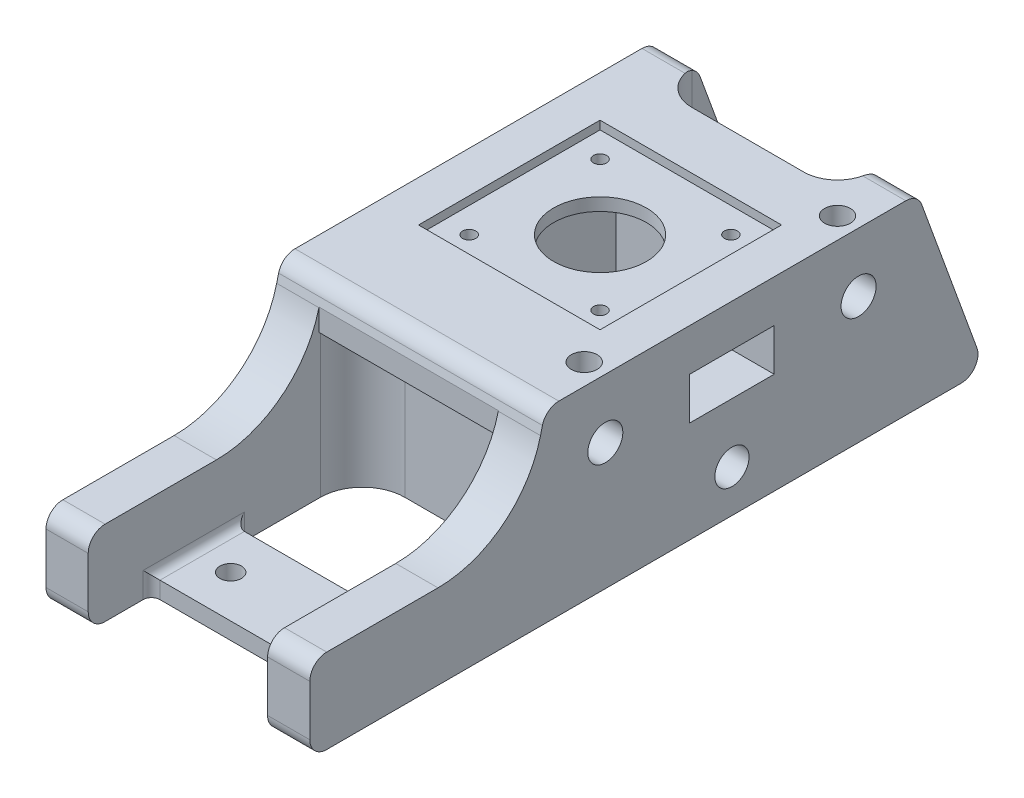
from build123d import *
from build123d.topology import SkipClean

# Parameters (mm, degrees)
SKETCH3_R            = 4.15
BOSS_EXTRUDE2_DEPTH  = 10
FILLET1_R            = 4
BOSS_EXTRUDE3_START  = 42.5
BOSS_EXTRUDE3_DEPTH  = 42.5
FILLET1_OF_MIRROR1_R = 4
SKETCH5_W            = 20
SKETCH5_H            = 10
CUT_EXTRUDE1_DEPTH   = 10
SKETCH6_R            = 11
CUT_EXTRUDE2_DEPTH   = 10
SKETCH7_W            = 43
SKETCH7_H            = 43
CUT_EXTRUDE3_DEPTH   = 2
SKETCH8_R            = 1.55
CUT_EXTRUDE4_DEPTH   = 5
SKETCH9_W            = 10
SKETCH9_H            = 34.15
BOSS_EXTRUDE4_DEPTH  = 42.5
FILLET2_R            = 10
FILLET3_R            = 8
SKETCH10_R           = 4.15
BOSS_EXTRUDE5_DEPTH  = 10
SKETCH11_R           = 4.05
CUT_EXTRUDE5_DEPTH   = 77
FILLET4_R            = 25
FILLET5_R            = 4
FILLET6_R            = 4
SKETCH13_R           = 3.05
CUT_EXTRUDE6_DEPTH   = 12
SKETCH14_W           = 20
SKETCH14_H           = 4
BOSS_EXTRUDE6_DEPTH  = 42.5
FILLET7_R            = 2
SKETCH16_W           = 40
SKETCH16_H           = 40
CUT_EXTRUDE8_DEPTH   = 5
FILLET9_R            = 2
BOSS_EXTRUDE7_DEPTH  = 4
FILLET10_R           = 8
SKETCH18_R           = 2.55
CUT_EXTRUDE9_DEPTH   = 120.81756974
FILLET11_R           = 2


with BuildPart() as part:
    # Sketch3 → Boss-Extrude2 (new body)
    with BuildSketch(Plane(origin=(0, 0, 0), x_dir=(0, 0, -1), z_dir=(1, 0, 0))):
        Polygon((60, 0), (-100, 0), (-100, 20), (-50, 20), (-44.154765862, 44), (43.985309692, 44), align=None)
        with Locations((-30, 30)):
            Circle(SKETCH3_R, mode=Mode.SUBTRACT)
        with Locations(Location((30, 30, 0), (0, 0, 180))):
            Circle(SKETCH3_R, mode=Mode.SUBTRACT)
    boss_extrude2 = extrude(amount=BOSS_EXTRUDE2_DEPTH)

    # Fillet1
    fillet1_edges = [part.edges().sort_by_distance(p)[0] for p in [
        (5, 0, -60),
        (5, 0, 100),
        (5, 44, -43.985309692),
    ]]
    fillet(fillet1_edges, radius=FILLET1_R)

    # Sketch4 → Boss-Extrude3 (add)
    with BuildSketch(Plane.ZY.offset(BOSS_EXTRUDE3_START)):
        with BuildLine():
            Line((-34.995012035, 44), (-34.995012035, 34))
            Line((-34.995012035, 34), (-31.105667219, 34))
            ThreePointArc((-31.105667219, 34), (-30, 34.15), (-28.894332781, 34))
            Line((-28.894332781, 34), (28.894332781, 34))
            ThreePointArc((28.894332781, 34), (30, 34.15), (31.105667219, 34))
            Line((31.105667219, 34), (45.322569059, 34))
            Line((45.322569059, 34), (45.322569059, 39.205106235))
            Line((45.322569059, 39.205106235), (44.154765862, 44))
            Line((44.154765862, 44), (-34.995012035, 44))
        make_face()
    extrude(amount=-BOSS_EXTRUDE3_DEPTH)

    # Mirror1: Boss-Extrude2 across plane
    add(boss_extrude2.mirror(Plane.ZY.offset(21.25)))

    # Fillet1 of Mirror1
    fillet1_of_mirror1_edges = [part.edges().sort_by_distance(p)[0] for p in [
        (-47.5, 0, -60),
        (-47.5, 0, 100),
        (-47.5, 44, -43.985309692),
    ]]
    fillet(fillet1_of_mirror1_edges, radius=FILLET1_OF_MIRROR1_R)

    # Sketch5 → Cut-Extrude1 (cut)
    with SkipClean():  # the faces are left unmerged after this step: merging them gives an invalid solid
        with BuildSketch(Plane(origin=(10, 0, 0), x_dir=(0, 0, -1), z_dir=(1, 0, 0))):
            with Locations((0, 29)):
                Rectangle(SKETCH5_W, SKETCH5_H)
        extrude(amount=-CUT_EXTRUDE1_DEPTH, mode=Mode.SUBTRACT)

    # Sketch6 → Cut-Extrude2 (cut)
    with SkipClean():  # the faces are left unmerged after this step: merging them gives an invalid solid
        with BuildSketch(Plane.XZ.offset(-34)):
            with Locations(Location((-21.25, 0, 0), (0, 0, 270))):
                Circle(SKETCH6_R)
        extrude(amount=-CUT_EXTRUDE2_DEPTH, mode=Mode.SUBTRACT)

    # Sketch7 → Cut-Extrude3 (cut)
    with SkipClean():  # the faces are left unmerged after this step: merging them gives an invalid solid
        with BuildSketch(Plane(origin=(0, 44, 0), x_dir=(1, 0, 0), z_dir=(0, 1, 0))):
            with Locations((-21.25, 0)):
                Rectangle(SKETCH7_W, SKETCH7_H)
        extrude(amount=-CUT_EXTRUDE3_DEPTH, mode=Mode.SUBTRACT)

    # Sketch8 → Cut-Extrude4 (cut)
    with SkipClean():  # the faces are left unmerged after this step: merging them gives an invalid solid
        with BuildSketch(Plane(origin=(0, 42, 0), x_dir=(1, 0, 0), z_dir=(0, 1, 0))):
            with Locations(Location((-36.75, 15.5, 0), (0, 0, 270))):
                Circle(SKETCH8_R)
            with Locations(Location((-5.75, 15.5, 0), (0, 0, 90))):
                Circle(SKETCH8_R)
            with Locations(Location((-5.75, -15.5, 0), (0, 0, 270))):
                Circle(SKETCH8_R)
            with Locations(Location((-36.75, -15.5, 0), (0, 0, 90))):
                Circle(SKETCH8_R)
        extrude(amount=-CUT_EXTRUDE4_DEPTH, mode=Mode.SUBTRACT)

    # Sketch9 → Boss-Extrude4 (add)
    with SkipClean():  # the faces are left unmerged after this step: merging them gives an invalid solid
        with BuildSketch(Plane.ZY):
            with Locations((30, 17.075)):
                Rectangle(SKETCH9_W, SKETCH9_H)
        boss_extrude4 = extrude(amount=BOSS_EXTRUDE4_DEPTH)

    # Mirror2: Boss-Extrude4 across plane
    add(boss_extrude4.mirror(Plane(origin=(0, 0, 0), x_dir=(1, 0, 0), z_dir=(0, 0, -1))))

    # Fillet2
    fillet2_edges = [part.edges().sort_by_distance(p)[0] for p in [
        (0, 17, 35),
        (-42.5, 17, 35),
    ]]
    fillet(fillet2_edges, radius=FILLET2_R)

    # Fillet3
    fillet3_edges = [part.edges().sort_by_distance(p)[0] for p in [
        (0, 17.075, -35),
        (-42.5, 17.075, -35),
    ]]
    fillet(fillet3_edges, radius=FILLET3_R)

    # Sketch10 → Boss-Extrude5 (add)
    with BuildSketch(Plane.ZY.offset(52.5)):
        with Locations(Location((30, 30, 0), (0, 0, 180))):
            Circle(SKETCH10_R)
        with Locations((-30, 30)):
            Circle(SKETCH10_R)
    extrude(amount=-BOSS_EXTRUDE5_DEPTH)

    # Sketch11 → Cut-Extrude5 (cut)
    with BuildSketch(Plane(origin=(10, 0, 0), x_dir=(0, 0, -1), z_dir=(1, 0, 0))):
        with Locations((0, 10)):
            Circle(SKETCH11_R)
    extrude(amount=-CUT_EXTRUDE5_DEPTH, mode=Mode.SUBTRACT)

    # Fillet4
    fillet4_edges = [part.edges().sort_by_distance(p)[0] for p in [
        (5, 20, 50),
        (-47.5, 20, 50),
    ]]
    fillet(fillet4_edges, radius=FILLET4_R)

    # Fillet5
    fillet5_edges = [part.edges().sort_by_distance(p)[0] for p in [
        (5, 20, 100),
        (-47.5, 20, 100),
    ]]
    fillet(fillet5_edges, radius=FILLET5_R)

    # Fillet6
    fillet6_edges = [part.edges().sort_by_distance(p)[0] for p in [
        (-21.25, 44, 44.154765862),
    ]]
    fillet(fillet6_edges, radius=FILLET6_R)

    # Sketch13 → Cut-Extrude6 (cut)
    with BuildSketch(Plane(origin=(0, 44, 0), x_dir=(1, 0, 0), z_dir=(0, 1, 0))):
        with Locations(Location((5, -30, 0), (0, 0, 270))):
            Circle(SKETCH13_R)
        with Locations(Location((5, 30, 0), (0, 0, 270))):
            Circle(SKETCH13_R)
    extrude(amount=-CUT_EXTRUDE6_DEPTH, mode=Mode.SUBTRACT)

    # Sketch14 → Boss-Extrude6 (add)
    with BuildSketch(Plane(origin=(-42.5, 0, 0), x_dir=(0, 0, -1), z_dir=(1, 0, 0))):
        with Locations((-75, 2)):
            Rectangle(SKETCH14_W, SKETCH14_H)
    extrude(amount=BOSS_EXTRUDE6_DEPTH)

    # Fillet7
    fillet7_edges = [part.edges().sort_by_distance(p)[0] for p in [
        (0, 2, 65),
        (-42.5, 2, 65),
        (0, 2, 85),
        (-42.5, 2, 85),
    ]]
    fillet(fillet7_edges, radius=FILLET7_R)

    # Sketch16 → Cut-Extrude8 (cut)
    with BuildSketch(Plane(origin=(0, 34, 0), x_dir=(-1, 0, 0), z_dir=(0, -1, 0))):
        with Locations((21.25, 0)):
            Rectangle(SKETCH16_W, SKETCH16_H)
    extrude(amount=-CUT_EXTRUDE8_DEPTH, mode=Mode.SUBTRACT)

    # Fillet9
    fillet9_edges = [part.edges().sort_by_distance(p)[0] for p in [
        (0, 4, 75),
        (-42.5, 4, 75),
    ]]
    fillet(fillet9_edges, radius=FILLET9_R)

    # Sketch17 → Boss-Extrude7 (add)
    with BuildSketch(Plane(origin=(0, 0, 0), x_dir=(-1, 0, 0), z_dir=(0, -1, 0))):
        with BuildLine():
            Line((42.5, 48.643703987), (0, 48.643703987))
            Line((0, 48.643703987), (0, 43))
            ThreePointArc((0, 43), (2.343145751, 37.343145751), (8, 35))
            Line((8, 35), (34.5, 35))
            ThreePointArc((34.5, 35), (40.156854249, 37.343145751), (42.5, 43))
            Line((42.5, 43), (42.5, 48.643703987))
        make_face()
    extrude(amount=-BOSS_EXTRUDE7_DEPTH)

    # Fillet10
    fillet10_edges = [part.edges().sort_by_distance(p)[0] for p in [
        (0, 39.075, -34.995012035),
        (-42.5, 39.075, -34.995012035),
    ]]
    fillet(fillet10_edges, radius=FILLET10_R)

    # Sketch18 → Cut-Extrude9 (cut, through all)
    with BuildSketch(Plane(origin=(0, 4, 0), x_dir=(1, 0, 0), z_dir=(0, 1, 0))):
        with Locations(Location((-33.75, 42.143703987, 0), (0, 0, 270))):
            Circle(SKETCH18_R)
        with Locations(Location((-33.75, -75, 0), (0, 0, 270))):
            Circle(SKETCH18_R)
        with Locations(Location((-8.75, -75, 0), (0, 0, 90))):
            Circle(SKETCH18_R)
        with Locations(Location((-8.75, 42.143703987, 0), (0, 0, 90))):
            Circle(SKETCH18_R)
    extrude(amount=-CUT_EXTRUDE9_DEPTH, mode=Mode.SUBTRACT)

    # Fillet11
    fillet11_edges = [part.edges().sort_by_distance(p)[0] for p in [
        (-42.5, 4, -45.821851993),
        (-40.156854249, 4, -37.343145751),
        (-21.25, 4, -35),
        (-2.343145751, 4, -37.343145751),
        (0, 4, -45.821851993),
    ]]
    fillet(fillet11_edges, radius=FILLET11_R)


solid = part.part
